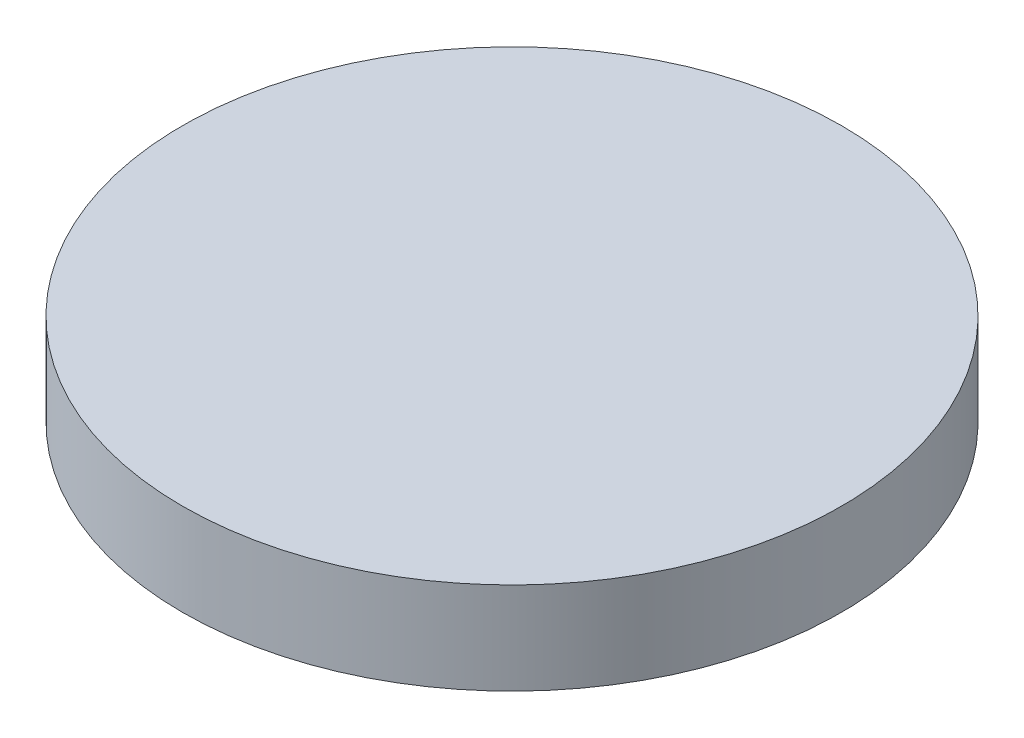
from build123d import *

# Parameters (mm, degrees)
SKETCH1_R           = 27.305
BOSS_EXTRUDE1_DEPTH = 7.62


with BuildPart() as part:
    # Sketch1 → Boss-Extrude1 (new body)
    with BuildSketch(Plane(origin=(0, 0, 0), x_dir=(1, 0, 0), z_dir=(0, 1, 0))):
        with Locations(Location((0, 0, 0), (0, 0, 90))):
            Circle(SKETCH1_R)
    extrude(amount=BOSS_EXTRUDE1_DEPTH)


solid = part.part
